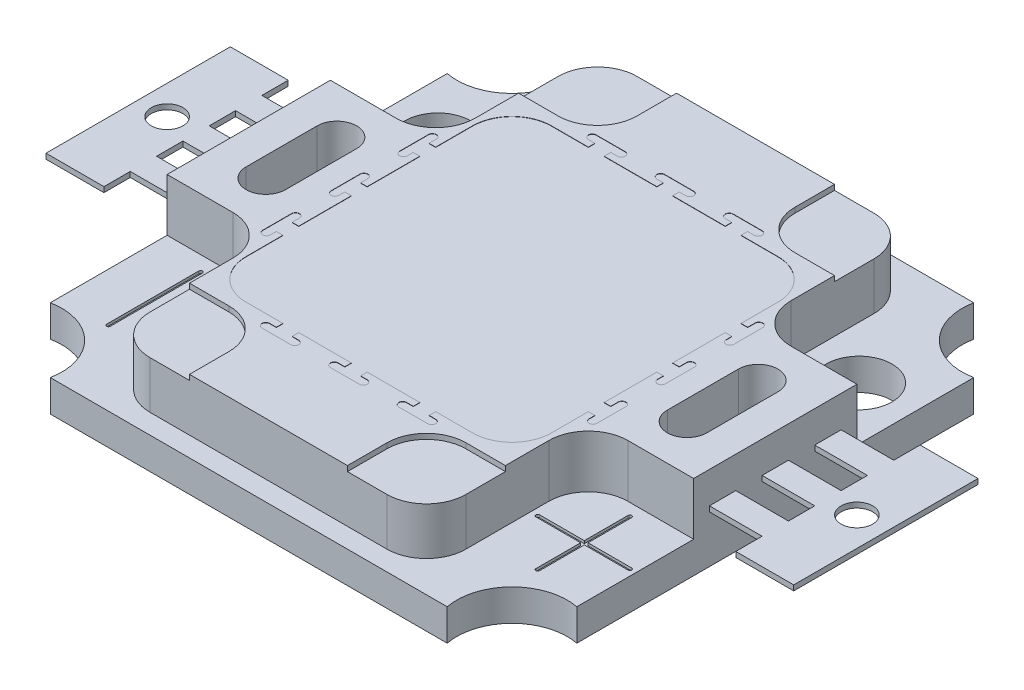
from build123d import *

# Parameters (mm, degrees)
SKETCH1_W            = 20
SKETCH1_H            = 20
BOSS_EXTRUDE1_DEPTH  = 1.2
SKETCH3_W            = 8
SKETCH3_H            = 10.1
BOSS_EXTRUDE2_DEPTH  = 2
FILLET1_R            = 1.5
SKETCH4_W            = 11.6
SKETCH4_H            = 11.6
SKETCH4_W_2          = 3
SKETCH4_H_2          = 3
CUT_EXTRUDE1_DEPTH   = 0.2
FILLET2_R            = 1.5
SKETCH5_R            = 2.1
CUT_EXTRUDE2_DEPTH   = 29.354893758
LPATTERN1_COUNT      = 2
LPATTERN1_PITCH      = 19.2
LPATTERN1_COUNT_DIR2 = 2
LPATTERN1_PITCH_DIR2 = 19.2
SKETCH6_R            = 0.6
BOSS_EXTRUDE3_DEPTH  = 0.2
CUT_EXTRUDE3_DEPTH   = 0.2
CUT_EXTRUDE4_DEPTH   = 0.2
SKETCH9_W            = 8
SKETCH9_H            = 10.1
BOSS_EXTRUDE4_DEPTH  = 1.8
BOSS_EXTRUDE5_DEPTH  = 0.19
SKETCH11_R           = 1.25
CUT_EXTRUDE5_DEPTH   = 32.458544149
CUT_EXTRUDE6_DEPTH   = 0.1


with BuildPart() as part:
    # Sketch1 → Boss-Extrude1 (new body)
    with BuildSketch(Plane(origin=(0, 0, 0), x_dir=(1, 0, 0), z_dir=(0, 1, 0))):
        with Locations((10, 10)):
            Rectangle(SKETCH1_W, SKETCH1_H)
    extrude(amount=BOSS_EXTRUDE1_DEPTH)

    # Sketch3 → Boss-Extrude2 (add)
    with BuildSketch(Plane(origin=(0, 1.2, 0), x_dir=(1, 0, 0), z_dir=(0, 1, 0))):
        Polygon((4, 19.25), (16, 19.25), (16, 13.1), (20, 13.1), (20, 6.9), (16, 6.9), (16, 0.75), (4, 0.75), (4, 6.9), (0, 6.9), (0, 13.1), (4, 13.1), align=None)
        with BuildLine():
            Line((17.25, 8.65), (17.25, 11.35))
            ThreePointArc((17.25, 11.35), (18, 12.1), (18.75, 11.35))
            Line((18.75, 11.35), (18.75, 8.65))
            ThreePointArc((18.75, 8.65), (18, 7.9), (17.25, 8.65))
        make_face(mode=Mode.SUBTRACT)
        with BuildLine():
            Line((2.75, 8.65), (2.75, 11.35))
            ThreePointArc((2.75, 11.35), (2, 12.1), (1.25, 11.35))
            Line((1.25, 11.35), (1.25, 8.65))
            ThreePointArc((1.25, 8.65), (2, 7.9), (2.75, 8.65))
        make_face(mode=Mode.SUBTRACT)
        with Locations((10, 10)):
            Rectangle(SKETCH3_W, SKETCH3_H, mode=Mode.SUBTRACT)
    extrude(amount=BOSS_EXTRUDE2_DEPTH)

    # Fillet1
    fillet1_edges = [part.edges().sort_by_distance(p)[0] for p in [
        (4, 2.2, -13.1),
        (4, 2.2, -6.9),
        (16, 2.2, -13.1),
        (16, 2.2, -6.9),
        (4, 2.2, -19.25),
        (16, 2.2, -19.25),
        (4, 2.2, -0.75),
        (16, 2.2, -0.75),
    ]]
    fillet(fillet1_edges, radius=FILLET1_R)

    # Sketch4 → Cut-Extrude1 (cut)
    with BuildSketch(Plane(origin=(0, 3.2, 0), x_dir=(1, 0, 0), z_dir=(0, 1, 0))):
        with Locations((10, 10)):
            Rectangle(SKETCH4_W, SKETCH4_H)
        with Locations((5.5, 2.25)):
            Rectangle(SKETCH4_W_2, SKETCH4_H_2)
        with Locations((14.5, 17.75)):
            Rectangle(SKETCH4_W_2, SKETCH4_H_2)
        with Locations((5.5, 17.75)):
            Rectangle(SKETCH4_W_2, SKETCH4_H_2)
        with Locations((14.5, 2.25)):
            Rectangle(SKETCH4_W_2, SKETCH4_H_2)
    extrude(amount=-CUT_EXTRUDE1_DEPTH, mode=Mode.SUBTRACT)

    # Fillet2
    fillet2_edges = [part.edges().sort_by_distance(p)[0] for p in [
        (13, 3.1, -16.25),
        (7, 3.1, -16.25),
        (7, 3.1, -3.75),
        (13, 3.1, -3.75),
        (15.8, 3.1, -4.2),
        (4.2, 3.1, -4.2),
        (4.2, 3.1, -15.8),
        (15.8, 3.1, -15.8),
    ]]
    fillet(fillet2_edges, radius=FILLET2_R)

    # Sketch5 → Cut-Extrude2 (cut, through all)
    with BuildSketch(Plane(origin=(0, 1.2, 0), x_dir=(1, 0, 0), z_dir=(0, 1, 0))):
        with Locations((0.4, 19.6)):
            Circle(SKETCH5_R)
    cut_extrude2 = extrude(amount=-CUT_EXTRUDE2_DEPTH, mode=Mode.SUBTRACT)

    # LPattern1: Cut-Extrude2 2 × 2
    with Locations(*[(i * LPATTERN1_PITCH, 0, j * LPATTERN1_PITCH_DIR2) for i in range(LPATTERN1_COUNT) for j in range(LPATTERN1_COUNT_DIR2) if (i, j) != (0, 0)]):
        add(cut_extrude2, mode=Mode.SUBTRACT)

    # Sketch6 → Boss-Extrude3 (add)
    # profile 1 of 2: a face of its own
    with BuildSketch(Plane(origin=(0, 2, 0), x_dir=(1, 0, 0), z_dir=(0, 1, 0))):
        Polygon((22, 13.5), (24.2, 13.5), (24.2, 6.5), (22, 6.5), (22, 7.5), (20, 7.5), (20, 8.5), (22, 8.5), (22, 9.5), (20, 9.5), (20, 10.5), (22, 10.5), (22, 11.5), (20, 11.5), (20, 12.5), (22, 12.5), align=None)
        with Locations((23.1, 10)):
            Circle(SKETCH6_R, mode=Mode.SUBTRACT)
    # profile 2 of 2: a face of its own
    with BuildSketch(Plane(origin=(0, 2, 0), x_dir=(1, 0, 0), z_dir=(0, 1, 0))):
        Polygon((-2, 9.5), (-2, 8.5), (0, 8.5), (0, 7.5), (-2, 7.5), (-2, 6.5), (-4.2, 6.5), (-4.2, 13.5), (-2, 13.5), (-2, 12.5), (0, 12.5), (0, 11.5), (-2, 11.5), (-2, 10.5), (0, 10.5), (0, 9.5), align=None)
        with Locations((-3.1, 10)):
            Circle(SKETCH6_R, mode=Mode.SUBTRACT)
    extrude(amount=-BOSS_EXTRUDE3_DEPTH)

    # Sketch7 → Cut-Extrude3 (cut)
    with BuildSketch(Plane(origin=(0, 3.2, 0), x_dir=(1, 0, 0), z_dir=(0, 1, 0))):
        with BuildLine():
            Line((9.45, 3.95), (9.7, 3.95))
            Line((9.7, 3.95), (9.7, 4.2))
            Line((9.7, 4.2), (10.3, 4.2))
            Line((10.3, 4.2), (10.3, 3.95))
            Line((10.3, 3.95), (10.55, 3.95))
            ThreePointArc((10.55, 3.95), (10.7, 3.8), (10.55, 3.65))
            Line((10.55, 3.65), (9.45, 3.65))
            ThreePointArc((9.45, 3.65), (9.3, 3.8), (9.45, 3.95))
        make_face()
        with BuildLine():
            Line((12.05, 3.95), (12.3, 3.95))
            Line((12.3, 3.95), (12.3, 4.2))
            Line((12.3, 4.2), (12.9, 4.2))
            Line((12.9, 4.2), (12.9, 3.95))
            Line((12.9, 3.95), (13.15, 3.95))
            ThreePointArc((13.15, 3.95), (13.3, 3.8), (13.15, 3.65))
            Line((13.15, 3.65), (12.05, 3.65))
            ThreePointArc((12.05, 3.65), (11.9, 3.8), (12.05, 3.95))
        make_face()
        with BuildLine():
            Line((6.85, 3.95), (7.1, 3.95))
            Line((7.1, 3.95), (7.1, 4.2))
            Line((7.1, 4.2), (7.7, 4.2))
            Line((7.7, 4.2), (7.7, 3.95))
            Line((7.7, 3.95), (7.95, 3.95))
            ThreePointArc((7.95, 3.95), (8.1, 3.8), (7.95, 3.65))
            Line((7.95, 3.65), (6.85, 3.65))
            ThreePointArc((6.85, 3.65), (6.7, 3.8), (6.85, 3.95))
        make_face()
        with BuildLine():
            Line((7.7, 16.05), (7.95, 16.05))
            ThreePointArc((7.95, 16.05), (8.1, 16.2), (7.95, 16.35))
            Line((7.95, 16.35), (6.85, 16.35))
            ThreePointArc((6.85, 16.35), (6.7, 16.2), (6.85, 16.05))
            Line((6.85, 16.05), (7.1, 16.05))
            Line((7.1, 16.05), (7.1, 15.8))
            Line((7.1, 15.8), (7.7, 15.8))
            Line((7.7, 15.8), (7.7, 16.05))
        make_face()
        with BuildLine():
            Line((10.3, 16.05), (10.55, 16.05))
            ThreePointArc((10.55, 16.05), (10.7, 16.2), (10.55, 16.35))
            Line((10.55, 16.35), (9.45, 16.35))
            ThreePointArc((9.45, 16.35), (9.3, 16.2), (9.45, 16.05))
            Line((9.45, 16.05), (9.7, 16.05))
            Line((9.7, 16.05), (9.7, 15.8))
            Line((9.7, 15.8), (10.3, 15.8))
            Line((10.3, 15.8), (10.3, 16.05))
        make_face()
        with BuildLine():
            Line((12.9, 16.05), (13.15, 16.05))
            ThreePointArc((13.15, 16.05), (13.3, 16.2), (13.15, 16.35))
            Line((13.15, 16.35), (12.05, 16.35))
            ThreePointArc((12.05, 16.35), (11.9, 16.2), (12.05, 16.05))
            Line((12.05, 16.05), (12.3, 16.05))
            Line((12.3, 16.05), (12.3, 15.8))
            Line((12.3, 15.8), (12.9, 15.8))
            Line((12.9, 15.8), (12.9, 16.05))
        make_face()
    extrude(amount=-CUT_EXTRUDE3_DEPTH, mode=Mode.SUBTRACT)

    # Sketch8 → Cut-Extrude4 (cut)
    with BuildSketch(Plane(origin=(0, 3.2, 0), x_dir=(1, 0, 0), z_dir=(0, 1, 0))):
        with BuildLine():
            Line((3.947553165, 6.850011974), (3.95, 7.1))
            Line((3.95, 7.1), (4.2, 7.1))
            Line((4.2, 7.1), (4.2, 7.7))
            Line((4.2, 7.7), (3.95, 7.7))
            Line((3.95, 7.7), (3.947548776, 7.949987983))
            ThreePointArc((3.947548776, 7.949987983), (3.813558827, 8.126380561), (3.65, 7.976994624))
            Line((3.65, 7.976994624), (3.65, 6.876994624))
            ThreePointArc((3.65, 6.876994624), (3.786453318, 6.727607585), (3.947553165, 6.850011974))
        make_face()
        with BuildLine():
            Line((3.947553165, 9.450011974), (3.95, 9.7))
            Line((3.95, 9.7), (4.2, 9.7))
            Line((4.2, 9.7), (4.2, 10.3))
            Line((4.2, 10.3), (3.95, 10.3))
            Line((3.95, 10.3), (3.947548776, 10.549987983))
            ThreePointArc((3.947548776, 10.549987983), (3.813558827, 10.726380561), (3.65, 10.576994624))
            Line((3.65, 10.576994624), (3.65, 9.476994624))
            ThreePointArc((3.65, 9.476994624), (3.786453318, 9.327607585), (3.947553165, 9.450011974))
        make_face()
        with BuildLine():
            Line((3.947553165, 12.050011974), (3.95, 12.3))
            Line((3.95, 12.3), (4.2, 12.3))
            Line((4.2, 12.3), (4.2, 12.9))
            Line((4.2, 12.9), (3.95, 12.9))
            Line((3.95, 12.9), (3.947548776, 13.149987983))
            ThreePointArc((3.947548776, 13.149987983), (3.813558827, 13.326380561), (3.65, 13.176994624))
            Line((3.65, 13.176994624), (3.65, 12.076994624))
            ThreePointArc((3.65, 12.076994624), (3.786453318, 11.927607585), (3.947553165, 12.050011974))
        make_face()
        with BuildLine():
            Line((16.35, 12.076994624), (16.35, 13.176994624))
            ThreePointArc((16.35, 13.176994624), (16.186441173, 13.326380561), (16.052451224, 13.149987983))
            Line((16.052451224, 13.149987983), (16.05, 12.9))
            Line((16.05, 12.9), (15.8, 12.9))
            Line((15.8, 12.9), (15.8, 12.3))
            Line((15.8, 12.3), (16.05, 12.3))
            Line((16.05, 12.3), (16.052446835, 12.050011974))
            ThreePointArc((16.052446835, 12.050011974), (16.213546682, 11.927607585), (16.35, 12.076994624))
        make_face()
        with BuildLine():
            Line((16.35, 6.876994624), (16.35, 7.976994624))
            ThreePointArc((16.35, 7.976994624), (16.186441173, 8.126380561), (16.052451224, 7.949987983))
            Line((16.052451224, 7.949987983), (16.05, 7.7))
            Line((16.05, 7.7), (15.8, 7.7))
            Line((15.8, 7.7), (15.8, 7.1))
            Line((15.8, 7.1), (16.05, 7.1))
            Line((16.05, 7.1), (16.052446835, 6.850011974))
            ThreePointArc((16.052446835, 6.850011974), (16.213546682, 6.727607585), (16.35, 6.876994624))
        make_face()
        with BuildLine():
            Line((16.35, 9.476994624), (16.35, 10.576994624))
            ThreePointArc((16.35, 10.576994624), (16.186441173, 10.726380561), (16.052451224, 10.549987983))
            Line((16.052451224, 10.549987983), (16.05, 10.3))
            Line((16.05, 10.3), (15.8, 10.3))
            Line((15.8, 10.3), (15.8, 9.7))
            Line((15.8, 9.7), (16.05, 9.7))
            Line((16.05, 9.7), (16.052446835, 9.450011974))
            ThreePointArc((16.052446835, 9.450011974), (16.213546682, 9.327607585), (16.35, 9.476994624))
        make_face()
    extrude(amount=-CUT_EXTRUDE4_DEPTH, mode=Mode.SUBTRACT)

    # Sketch11 → Cut-Extrude5 (cut, through all)
    with BuildSketch(Plane(origin=(0, 1.2, 0), x_dir=(1, 0, 0), z_dir=(0, 1, 0))):
        with Locations((2, 15.182559877)):
            Circle(SKETCH11_R)
        with Locations((18, 15.182559877)):
            Circle(SKETCH11_R)
    extrude(amount=-CUT_EXTRUDE5_DEPTH, mode=Mode.SUBTRACT)

    # Sketch12 → Cut-Extrude6 (cut)
    with BuildSketch(Plane(origin=(0, 1.2, 0), x_dir=(1, 0, 0), z_dir=(0, 1, 0))):
        with BuildLine():
            Line((18.108890137, 6.438478177), (18.108890137, 4.778478177))
            Line((18.108890137, 4.778478177), (19.768890137, 4.778478177))
            ThreePointArc((19.768890137, 4.778478177), (19.838890137, 4.708478177), (19.768890137, 4.638478177))
            Line((19.768890137, 4.638478177), (18.108890137, 4.638478177))
            Line((18.108890137, 4.638478177), (18.108890137, 2.938478177))
            ThreePointArc((18.108890137, 2.938478177), (18.038890137, 2.868478177), (17.968890137, 2.938478177))
            Line((17.968890137, 2.938478177), (17.968890137, 4.638478177))
            Line((17.968890137, 4.638478177), (16.268890137, 4.638478177))
            ThreePointArc((16.268890137, 4.638478177), (16.198890137, 4.708478177), (16.268890137, 4.778478177))
            Line((16.268890137, 4.778478177), (17.968890137, 4.778478177))
            Line((17.968890137, 4.778478177), (17.968890137, 6.438478177))
            ThreePointArc((17.968890137, 6.438478177), (18.038890137, 6.508478177), (18.108890137, 6.438478177))
        make_face()
        with BuildLine():
            Line((1.916294089, 6.325243287), (1.916294089, 2.825243287))
            ThreePointArc((1.916294089, 2.825243287), (1.846294089, 2.755243287), (1.776294089, 2.825243287))
            Line((1.776294089, 2.825243287), (1.776294089, 6.325243287))
            ThreePointArc((1.776294089, 6.325243287), (1.846294089, 6.395243287), (1.916294089, 6.325243287))
        make_face()
    extrude(amount=-CUT_EXTRUDE6_DEPTH, mode=Mode.SUBTRACT)


with BuildPart() as body_2:
    # Sketch9 → Boss-Extrude4 (new body)
    with BuildSketch(Plane(origin=(0, 1.2, 0), x_dir=(1, 0, 0), z_dir=(0, 1, 0))):
        with Locations((10, 10)):
            Rectangle(SKETCH9_W, SKETCH9_H)
    extrude(amount=BOSS_EXTRUDE4_DEPTH)


with BuildPart() as body_3:
    # Sketch10 → Boss-Extrude5 (new body)
    with BuildSketch(Plane(origin=(0, 3, 0), x_dir=(1, 0, 0), z_dir=(0, 1, 0))):
        with BuildLine():
            Line((5.7, 4.2), (7.1, 4.2))
            Line((7.1, 4.2), (7.1, 3.95))
            Line((7.1, 3.95), (6.85, 3.95))
            ThreePointArc((6.85, 3.95), (6.7, 3.8), (6.85, 3.65))
            Line((6.85, 3.65), (7.95, 3.65))
            ThreePointArc((7.95, 3.65), (8.1, 3.8), (7.95, 3.95))
            Line((7.95, 3.95), (7.7, 3.95))
            Line((7.7, 3.95), (7.7, 4.2))
            Line((7.7, 4.2), (9.7, 4.2))
            Line((9.7, 4.2), (9.7, 3.95))
            Line((9.7, 3.95), (9.45, 3.95))
            ThreePointArc((9.45, 3.95), (9.3, 3.8), (9.45, 3.65))
            Line((9.45, 3.65), (10.55, 3.65))
            ThreePointArc((10.55, 3.65), (10.7, 3.8), (10.55, 3.95))
            Line((10.55, 3.95), (10.3, 3.95))
            Line((10.3, 3.95), (10.3, 4.2))
            Line((10.3, 4.2), (12.3, 4.2))
            Line((12.3, 4.2), (12.3, 3.95))
            Line((12.3, 3.95), (12.05, 3.95))
            ThreePointArc((12.05, 3.95), (11.9, 3.8), (12.05, 3.65))
            Line((12.05, 3.65), (13.15, 3.65))
            ThreePointArc((13.15, 3.65), (13.3, 3.8), (13.15, 3.95))
            Line((13.15, 3.95), (12.9, 3.95))
            Line((12.9, 3.95), (12.9, 4.2))
            Line((12.9, 4.2), (14.3, 4.2))
            ThreePointArc((14.3, 4.2), (15.360660172, 4.639339828), (15.8, 5.7))
            Line((15.8, 5.7), (15.8, 7.1))
            Line((15.8, 7.1), (16.05, 7.1))
            Line((16.05, 7.1), (16.052446835, 6.850011974))
            ThreePointArc((16.052446835, 6.850011974), (16.213546682, 6.727607585), (16.35, 6.876994624))
            Line((16.35, 6.876994624), (16.35, 7.976994624))
            ThreePointArc((16.35, 7.976994624), (16.186441173, 8.126380561), (16.052451224, 7.949987983))
            Line((16.052451224, 7.949987983), (16.05, 7.7))
            Line((16.05, 7.7), (15.8, 7.7))
            Line((15.8, 7.7), (15.8, 9.7))
            Line((15.8, 9.7), (16.05, 9.7))
            Line((16.05, 9.7), (16.052446835, 9.450011974))
            ThreePointArc((16.052446835, 9.450011974), (16.213546682, 9.327607585), (16.35, 9.476994624))
            Line((16.35, 9.476994624), (16.35, 10.576994624))
            ThreePointArc((16.35, 10.576994624), (16.186441173, 10.726380561), (16.052451224, 10.549987983))
            Line((16.052451224, 10.549987983), (16.05, 10.3))
            Line((16.05, 10.3), (15.8, 10.3))
            Line((15.8, 10.3), (15.8, 12.3))
            Line((15.8, 12.3), (16.05, 12.3))
            Line((16.05, 12.3), (16.052446835, 12.050011974))
            ThreePointArc((16.052446835, 12.050011974), (16.213546682, 11.927607585), (16.35, 12.076994624))
            Line((16.35, 12.076994624), (16.35, 13.176994624))
            ThreePointArc((16.35, 13.176994624), (16.186441173, 13.326380561), (16.052451224, 13.149987983))
            Line((16.052451224, 13.149987983), (16.05, 12.9))
            Line((16.05, 12.9), (15.8, 12.9))
            Line((15.8, 12.9), (15.8, 14.3))
            ThreePointArc((15.8, 14.3), (15.360660172, 15.360660172), (14.3, 15.8))
            Line((14.3, 15.8), (12.9, 15.8))
            Line((12.9, 15.8), (12.9, 16.05))
            Line((12.9, 16.05), (13.15, 16.05))
            ThreePointArc((13.15, 16.05), (13.3, 16.2), (13.15, 16.35))
            Line((13.15, 16.35), (12.05, 16.35))
            ThreePointArc((12.05, 16.35), (11.9, 16.2), (12.05, 16.05))
            Line((12.05, 16.05), (12.3, 16.05))
            Line((12.3, 16.05), (12.3, 15.8))
            Line((12.3, 15.8), (10.3, 15.8))
            Line((10.3, 15.8), (10.3, 16.05))
            Line((10.3, 16.05), (10.55, 16.05))
            ThreePointArc((10.55, 16.05), (10.7, 16.2), (10.55, 16.35))
            Line((10.55, 16.35), (9.45, 16.35))
            ThreePointArc((9.45, 16.35), (9.3, 16.2), (9.45, 16.05))
            Line((9.45, 16.05), (9.7, 16.05))
            Line((9.7, 16.05), (9.7, 15.8))
            Line((9.7, 15.8), (7.7, 15.8))
            Line((7.7, 15.8), (7.7, 16.05))
            Line((7.7, 16.05), (7.95, 16.05))
            ThreePointArc((7.95, 16.05), (8.1, 16.2), (7.95, 16.35))
            Line((7.95, 16.35), (6.85, 16.35))
            ThreePointArc((6.85, 16.35), (6.7, 16.2), (6.85, 16.05))
            Line((6.85, 16.05), (7.1, 16.05))
            Line((7.1, 16.05), (7.1, 15.8))
            Line((7.1, 15.8), (5.7, 15.8))
            ThreePointArc((5.7, 15.8), (4.639339828, 15.360660172), (4.2, 14.3))
            Line((4.2, 14.3), (4.2, 12.9))
            Line((4.2, 12.9), (3.95, 12.9))
            Line((3.95, 12.9), (3.947548776, 13.149987983))
            ThreePointArc((3.947548776, 13.149987983), (3.813558827, 13.326380561), (3.65, 13.176994624))
            Line((3.65, 13.176994624), (3.65, 12.076994624))
            ThreePointArc((3.65, 12.076994624), (3.786453318, 11.927607585), (3.947553165, 12.050011974))
            Line((3.947553165, 12.050011974), (3.95, 12.3))
            Line((3.95, 12.3), (4.2, 12.3))
            Line((4.2, 12.3), (4.2, 10.3))
            Line((4.2, 10.3), (3.95, 10.3))
            Line((3.95, 10.3), (3.947548776, 10.549987983))
            ThreePointArc((3.947548776, 10.549987983), (3.813558827, 10.726380561), (3.65, 10.576994624))
            Line((3.65, 10.576994624), (3.65, 9.476994624))
            ThreePointArc((3.65, 9.476994624), (3.786453318, 9.327607585), (3.947553165, 9.450011974))
            Line((3.947553165, 9.450011974), (3.95, 9.7))
            Line((3.95, 9.7), (4.2, 9.7))
            Line((4.2, 9.7), (4.2, 7.7))
            Line((4.2, 7.7), (3.95, 7.7))
            Line((3.95, 7.7), (3.947548776, 7.949987983))
            ThreePointArc((3.947548776, 7.949987983), (3.813558827, 8.126380561), (3.65, 7.976994624))
            Line((3.65, 7.976994624), (3.65, 6.876994624))
            ThreePointArc((3.65, 6.876994624), (3.786453318, 6.727607585), (3.947553165, 6.850011974))
            Line((3.947553165, 6.850011974), (3.95, 7.1))
            Line((3.95, 7.1), (4.2, 7.1))
            Line((4.2, 7.1), (4.2, 5.7))
            ThreePointArc((4.2, 5.7), (4.639339828, 4.639339828), (5.7, 4.2))
        make_face()
    extrude(amount=BOSS_EXTRUDE5_DEPTH)


solid = Compound([part.part, body_2.part, body_3.part])
